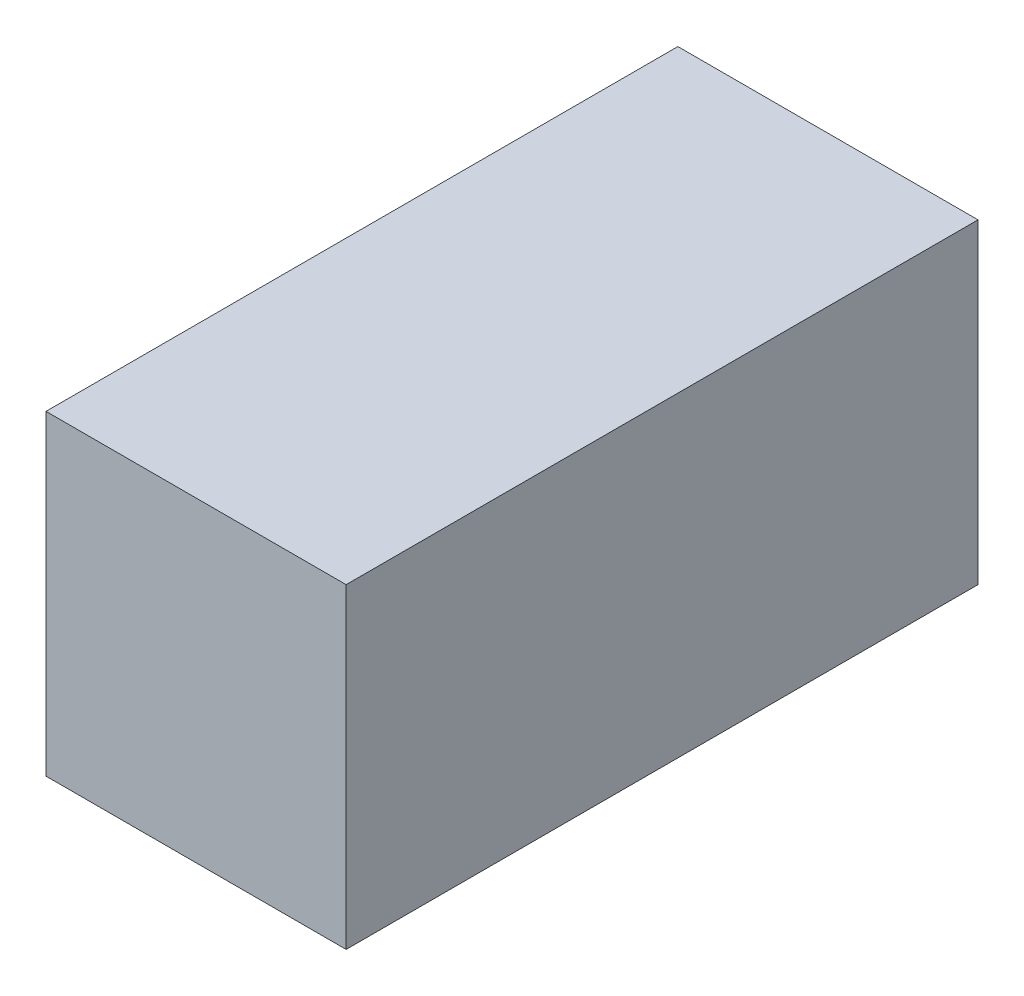
from build123d import *

# Parameters (mm, degrees)
SKETCH1_W           = 40
SKETCH1_H           = 20
BOSS_EXTRUDE1_DEPTH = 19


with BuildPart() as part:
    # Sketch1 → Boss-Extrude1 (new body)
    with BuildSketch(Plane(origin=(0, 0, 0), x_dir=(0, 0, -1), z_dir=(1, 0, 0))):
        with Locations((20, 10)):
            Rectangle(SKETCH1_W, SKETCH1_H)
    extrude(amount=-BOSS_EXTRUDE1_DEPTH)


solid = part.part
